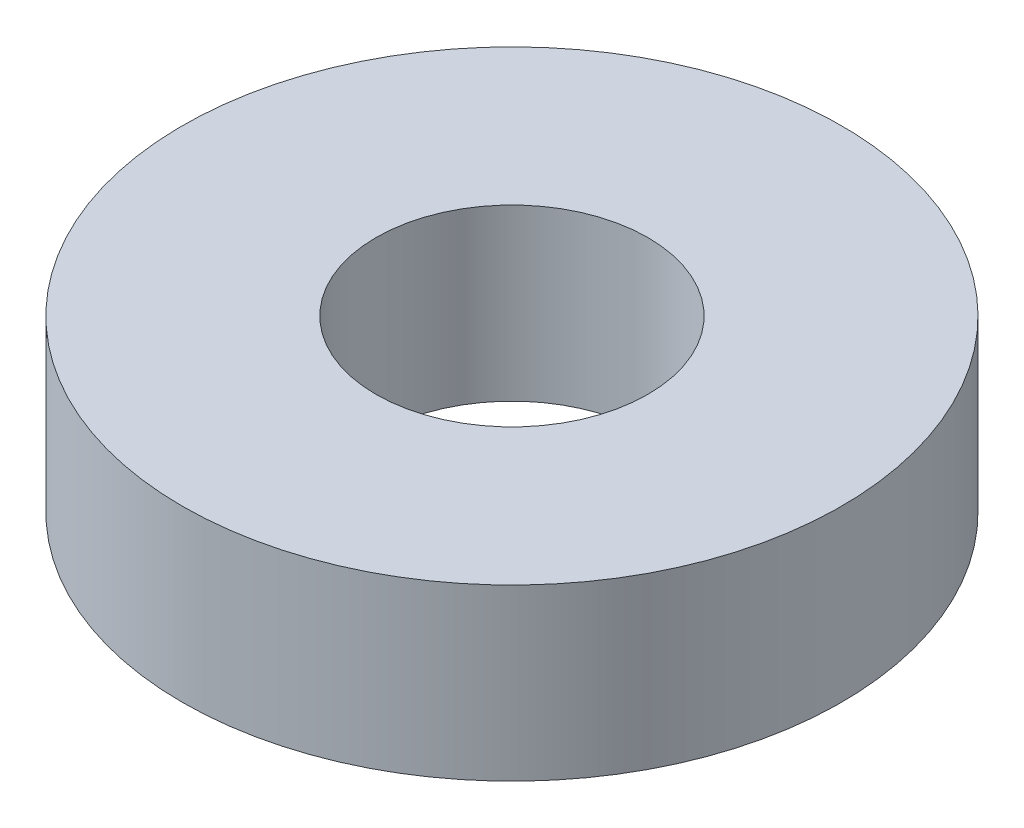
from build123d import *

# Parameters (mm, degrees)
SKETCH_1_R      = 9.7
SKETCH_1_R_2    = 4
EXTRUDE_1_DEPTH = 5


with BuildPart() as part:
    # 스케치1 → 보스-돌출1 (new body)
    with BuildSketch(Plane(origin=(0, 0, 0), x_dir=(1, 0, 0), z_dir=(0, 1, 0))):
        with Locations(Location((0, 0, 0), (0, 0, 270))):
            Circle(SKETCH_1_R)
        with Locations(Location((0, 0, 0), (0, 0, 270))):
            Circle(SKETCH_1_R_2, mode=Mode.SUBTRACT)
    extrude(amount=EXTRUDE_1_DEPTH)


solid = part.part
